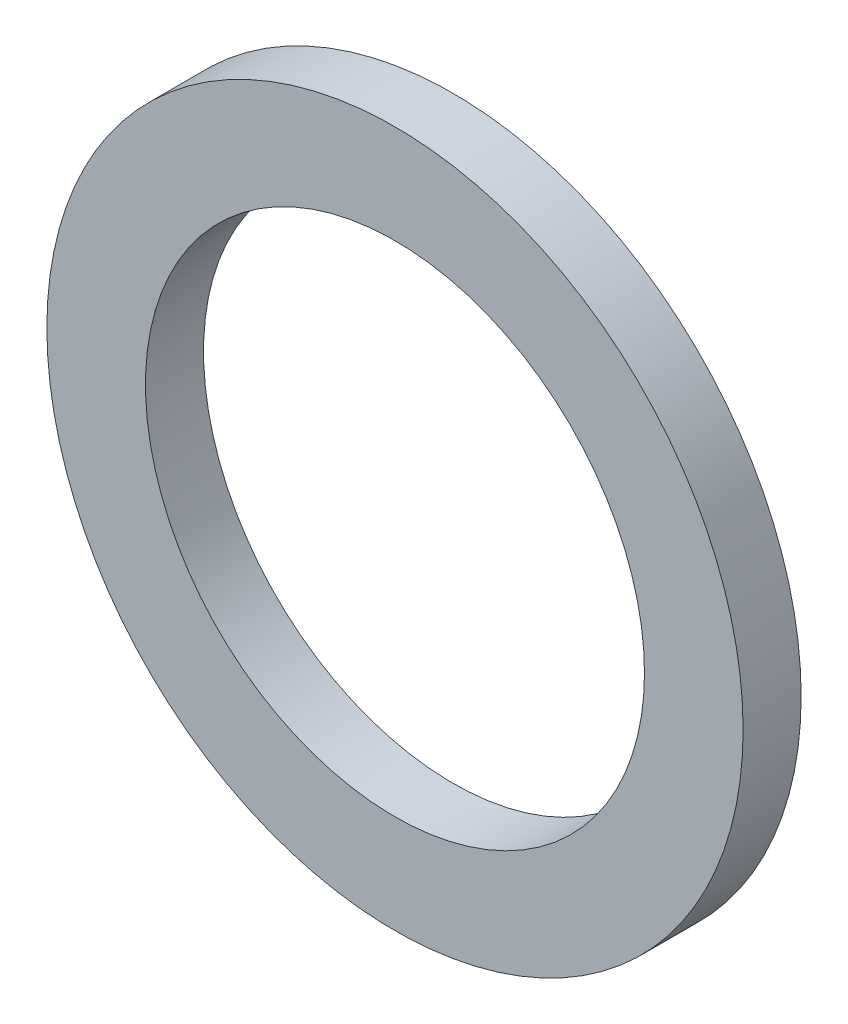
from build123d import *

# Parameters (mm, degrees)
SKETCH1_R          = 6
SLEEVE_OUTER_DEPTH = 1
SLEEVE_BORE_START  = -0.1
SKETCH2_R          = 4.3
SLEEVE_BORE_DEPTH  = 1.2


with BuildPart() as part:
    # Sketch1 → Sleeve_Outer (new body)
    with BuildSketch(Plane.XY):
        Circle(SKETCH1_R)
    extrude(amount=SLEEVE_OUTER_DEPTH)

    # Sketch2 → Sleeve_Bore (cut)
    with BuildSketch(Plane.XY.offset(SLEEVE_BORE_START)):
        Circle(SKETCH2_R)
    extrude(amount=SLEEVE_BORE_DEPTH, mode=Mode.SUBTRACT)


solid = part.part
